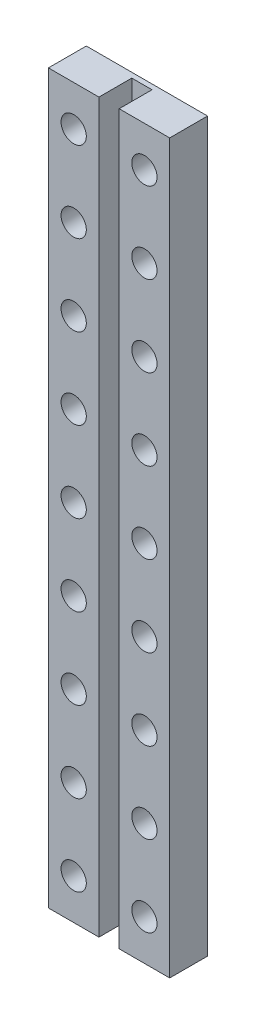
from build123d import *

# Parameters (mm, degrees)
BASE_DEPTH  = 144
ESQUISSE2_R = 2.5
TROU_DEPTH  = 145.693641878


with BuildPart() as part:
    # Esquisse1 → BASE (new body)
    with BuildSketch(Plane(origin=(0, 0, 0), x_dir=(1, 0, 0), z_dir=(0, 1, 0))):
        Polygon((-2, -3.75), (-2, 2.75), (2, 2.75), (2, -3.75), (12, -3.75), (12, 3.75), (-12, 3.75), (-12, -3.75), align=None)
    extrude(amount=-BASE_DEPTH)

    # Esquisse2 → TROU (cut, through all)
    with BuildSketch(Plane.XY.offset(3.75)):
        with Locations((-7, -8)):
            Circle(ESQUISSE2_R)
        with Locations((7, -8)):
            Circle(ESQUISSE2_R)
        with Locations((7, -24)):
            Circle(ESQUISSE2_R)
        with Locations((7, -40)):
            Circle(ESQUISSE2_R)
        with Locations((7, -56)):
            Circle(ESQUISSE2_R)
        with Locations((7, -72)):
            Circle(ESQUISSE2_R)
        with Locations((7, -88)):
            Circle(ESQUISSE2_R)
        with Locations((7, -104)):
            Circle(ESQUISSE2_R)
        with Locations((7, -120)):
            Circle(ESQUISSE2_R)
        with Locations((7, -136)):
            Circle(ESQUISSE2_R)
        with Locations((-7, -24)):
            Circle(ESQUISSE2_R)
        with Locations((-7, -40)):
            Circle(ESQUISSE2_R)
        with Locations((-7, -56)):
            Circle(ESQUISSE2_R)
        with Locations((-7, -72)):
            Circle(ESQUISSE2_R)
        with Locations((-7, -88)):
            Circle(ESQUISSE2_R)
        with Locations((-7, -104)):
            Circle(ESQUISSE2_R)
        with Locations((-7, -120)):
            Circle(ESQUISSE2_R)
        with Locations((-7, -136)):
            Circle(ESQUISSE2_R)
    extrude(amount=-TROU_DEPTH, mode=Mode.SUBTRACT)


solid = part.part
